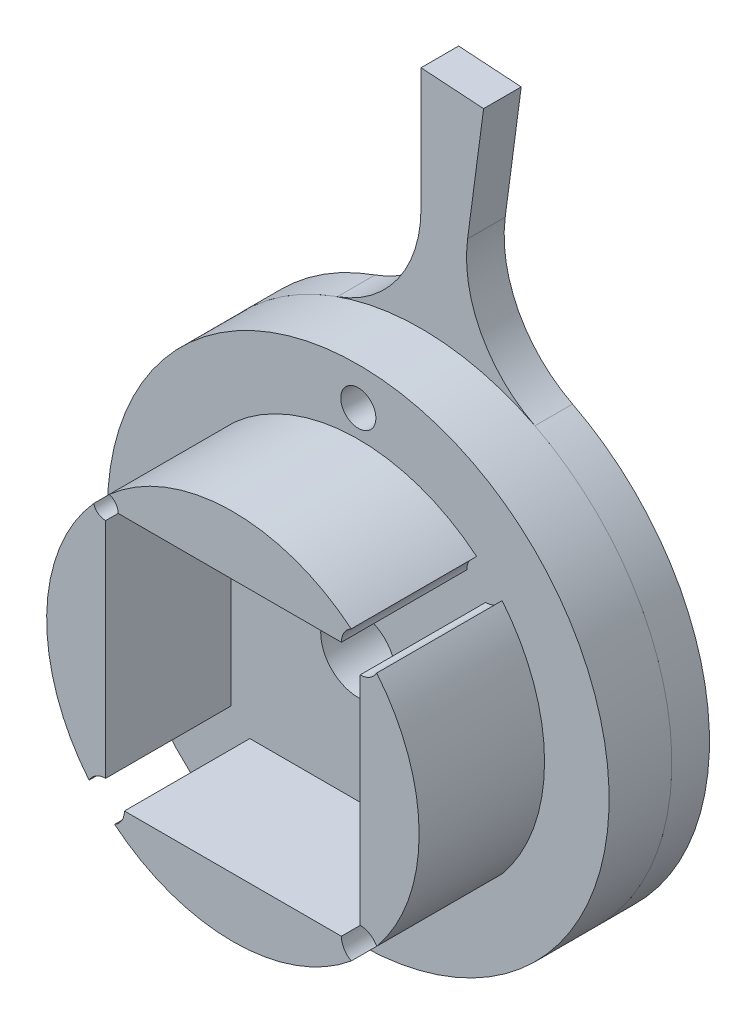
from build123d import *

# Parameters (mm, degrees)
EXTRUDE_1_DEPTH     = 10
EXTRUDE_1_2_DEPTH   = 10
EXTRUDE_1_3_DEPTH   = 10
EXTRUDE_1_4_DEPTH   = 10
SKETCH_3_R          = 20
SKETCH_3_R_2        = 3
EXTRUDE_3_DEPTH     = 5
SKETCH_4_R          = 20
SKETCH_4_R_2        = 3
EXTRUDE_4_DEPTH     = 3
EXTRUDE_START       = -3
EXTRUDE_7_DEPTH     = 3
FILLET_2_R          = 10
SKETCH_5_R          = 1.4
CUT_EXTRUDE_1_DEPTH = 10


with BuildPart() as part:
    # 草图1 → 凸台-拉伸1 (new body)
    with BuildSketch(Plane.XY):
        with BuildLine():
            ThreePointArc((-9.857615433, 11.106300823), (-9.346139139, 10.744817381), (-9.15, 10.15))
            Line((-9.15, 10.15), (8.65, 10.15))
            ThreePointArc((8.65, 10.15), (8.860862551, 10.916892847), (9.434166184, 11.468173717))
            ThreePointArc((9.434166184, 11.468173717), (-0.278505501, 14.847388144), (-9.857615433, 11.106300823))
        make_face()
    extrude(amount=EXTRUDE_1_DEPTH)



with BuildPart() as body_2:
    # 草图1 → Extrude 1 2 (new body)
    with BuildSketch(Plane.XY):
        with BuildLine():
            Line((-10.15, -8.65), (-10.15, 9.15))
            ThreePointArc((-10.15, 9.15), (-10.744817381, 9.346139139), (-11.106300823, 9.857615433))
            ThreePointArc((-11.106300823, 9.857615433), (-14.847388144, 0.278505501), (-11.468173717, -9.434166184))
            ThreePointArc((-11.468173717, -9.434166184), (-10.916892847, -8.860862551), (-10.15, -8.65))
        make_face()
    extrude(amount=EXTRUDE_1_2_DEPTH)


with BuildPart() as body_3:
    # 草图1 → Extrude 1 3 (new body)
    with BuildSketch(Plane.XY):
        with BuildLine():
            ThreePointArc((11.468173717, 9.434166184), (10.916892847, 8.860862551), (10.15, 8.65))
            Line((10.15, 8.65), (10.15, -8.65))
            ThreePointArc((10.15, -8.65), (10.916892847, -8.860862551), (11.468173717, -9.434166184))
            ThreePointArc((11.468173717, -9.434166184), (13.978999959, -5.010993928), (14.85, 0))
            ThreePointArc((14.85, 0), (13.978999959, 5.010993928), (11.468173717, 9.434166184))
        make_face()
    extrude(amount=EXTRUDE_1_3_DEPTH)


with BuildPart() as body_4:
    # 草图1 → Extrude 1 4 (new body)
    with BuildSketch(Plane.XY):
        with BuildLine():
            Line((8.65, -10.15), (-8.65, -10.15))
            ThreePointArc((-8.65, -10.15), (-8.860862551, -10.916892847), (-9.434166184, -11.468173717))
            ThreePointArc((-9.434166184, -11.468173717), (0, -14.85), (9.434166184, -11.468173717))
            ThreePointArc((9.434166184, -11.468173717), (8.860862551, -10.916892847), (8.65, -10.15))
        make_face()
    extrude(amount=EXTRUDE_1_4_DEPTH)


with BuildPart() as part_1:
    add(part.part)

    add(body_2.part)  # 凸台-拉伸3 merges body 2

    add(body_3.part)  # 凸台-拉伸3 merges body 3

    add(body_4.part)  # 凸台-拉伸3 merges body 4
    # 草图3 → 凸台-拉伸3 (add)
    with BuildSketch(Plane(origin=(0, 0, 0), x_dir=(-1, 0, 0), z_dir=(0, 0, -1))):
        Circle(SKETCH_3_R)
        Circle(SKETCH_3_R_2, mode=Mode.SUBTRACT)
    extrude(amount=EXTRUDE_3_DEPTH)

    # 草图4 → 凸台-拉伸4 (add)
    with BuildSketch(Plane(origin=(0, 0, -5), x_dir=(-1, 0, 0), z_dir=(0, 0, -1))):
        Circle(SKETCH_4_R)
        Circle(SKETCH_4_R_2, mode=Mode.SUBTRACT)
    extrude(amount=EXTRUDE_4_DEPTH)

    # 草图9 → 凸台-拉伸7 (add)
    with BuildSketch(Plane(origin=(0, 0, -8), x_dir=(-1, 0, 0), z_dir=(0, 0, -1)).offset(EXTRUDE_START)):
        with BuildLine():
            Line((0, 20), (0, 38))
            Line((0, 38), (-4.989167629, 37.671052632))
            Line((-4.989167629, 37.671052632), (-2.625877699, 19.826869806))
            ThreePointArc((-2.625877699, 19.826869806), (-1.315789474, 19.956670515), (0, 20))
        make_face()
    extrude(amount=EXTRUDE_7_DEPTH)

    # 圆角2
    fillet_2_edges = [part_1.edges().sort_by_distance(p)[0] for p in [
        (0, 20, -6.5),
        (2.625877699, 19.826869806, -6.5),
    ]]
    fillet(fillet_2_edges, radius=FILLET_2_R)


with BuildPart() as body_2_2:
    # Split Bodies 1: the piece on the far side of the plane
    add(part_1.part)
    split(bisect_by=Plane(origin=(0, 0, -5), x_dir=(-1, 0, 0), z_dir=(0, 0, -1)), keep=Keep.BOTTOM)


with BuildPart() as part_2:
    add(part_1.part)

    # Split Bodies 1
    split(bisect_by=Plane(origin=(0, 0, -5), x_dir=(-1, 0, 0), z_dir=(0, 0, -1)), keep=Keep.TOP)


with BuildPart() as cut_extrude_1_tool:
    # 草图5 → 切除-拉伸1 (new body)
    with BuildSketch(Plane(origin=(0, 0, -8), x_dir=(-1, 0, 0), z_dir=(0, 0, -1))):
        with Locations((0, 17)):
            Circle(SKETCH_5_R)
    extrude(amount=-CUT_EXTRUDE_1_DEPTH)


with BuildPart() as part_3:
    add(part_2.part)

    # 切除-拉伸1: cut by cut_extrude_1_tool
    add(cut_extrude_1_tool.part, mode=Mode.SUBTRACT)


with BuildPart() as body_2_2_1:
    add(body_2_2.part)

    # 切除-拉伸1: cut by cut_extrude_1_tool
    add(cut_extrude_1_tool.part, mode=Mode.SUBTRACT)


solid = Compound([part_3.part, body_2_2_1.part])
